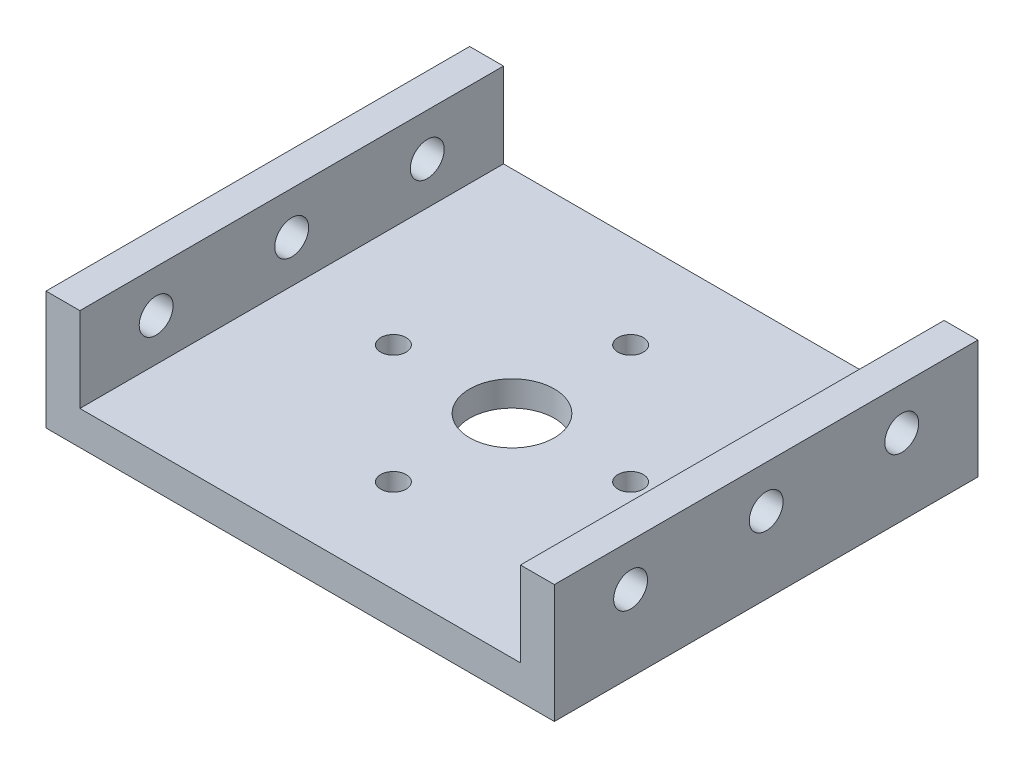
from build123d import *

# Parameters (mm, degrees)
EXTRUDE_1_DEPTH     = 25
SKETCH_3_R          = 5
SKETCH_3_R_2        = 1.5
CUT_EXTRUDE_2_DEPTH = 4
SKETCH_4_R          = 14
CUT_EXTRUDE_3_DEPTH = 1
SKETCH_2_R          = 2
CUT_EXTRUDE_4_DEPTH = 67.49060084


with BuildPart() as part:
    # 草图1 → 凸台-拉伸1 (new, symmetric)
    with BuildSketch(Plane.XY):
        Polygon((30, 0), (-30, 0), (-30, 14), (-26, 14), (-26, 4), (26, 4), (26, 14), (30, 14), align=None)
    extrude(amount=EXTRUDE_1_DEPTH, both=True)

    # 草图3 → 切除-拉伸2 (cut)
    with BuildSketch(Plane(origin=(0, 4, 0), x_dir=(1, 0, 0), z_dir=(0, 1, 0))):
        with Locations(Location((0, 0, 0), (0, 0, 270))):
            Circle(SKETCH_3_R)
        with Locations(Location((0, 14, 0), (0, 0, 270))):
            Circle(SKETCH_3_R_2)
        with Locations(Location((14, 0, 0), (0, 0, 270))):
            Circle(SKETCH_3_R_2)
        with Locations(Location((0, -14, 0), (0, 0, 270))):
            Circle(SKETCH_3_R_2)
        with Locations(Location((-14, 0, 0), (0, 0, 270))):
            Circle(SKETCH_3_R_2)
    extrude(amount=-CUT_EXTRUDE_2_DEPTH, mode=Mode.SUBTRACT)

    # 草图4 → 切除-拉伸3 (cut)
    with BuildSketch(Plane.XZ):
        Circle(SKETCH_4_R)
    extrude(amount=-CUT_EXTRUDE_3_DEPTH, mode=Mode.SUBTRACT)

    # 草图2 → 切除-拉伸4 (cut, through all)
    with BuildSketch(Plane(origin=(30, 0, 0), x_dir=(0, 0, -1), z_dir=(1, 0, 0))):
        with Locations((-16, 9)):
            Circle(SKETCH_2_R)
        with Locations((0, 9)):
            Circle(SKETCH_2_R)
        with Locations((16, 9)):
            Circle(SKETCH_2_R)
    extrude(amount=-CUT_EXTRUDE_4_DEPTH, mode=Mode.SUBTRACT)


solid = part.part
